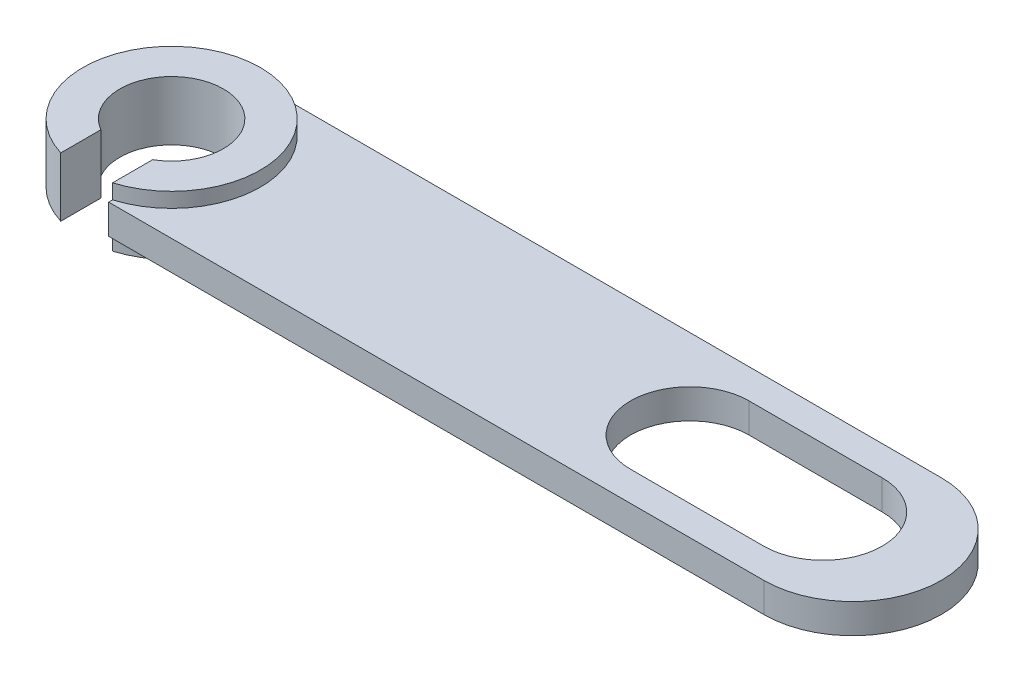
from build123d import *

# Parameters (mm, degrees)
SCHIZZO1_R                    = 1.75
ESTRUSIONE_ESTRUSIONE1_DEPTH  = 0.5
TAGLIO_ESTRUSIONE2_DEPTH      = 15.81553239
TAGLIO_ESTRUSIONE2_DEPTH_BACK = 15.81553239
ESTRUSIONE_ESTRUSIONE2_DEPTH  = 1


with BuildPart() as part:
    # Schizzo1 → Estrusione-Estrusione1 (new, symmetric)
    with BuildSketch(Plane(origin=(0, 0, 0), x_dir=(1, 0, 0), z_dir=(0, 1, 0))):
        with BuildLine():
            Line((-11.5, 3), (11.5, 3))
            ThreePointArc((11.5, 3), (14.5, 0), (11.5, -3))
            Line((11.5, -3), (-11.5, -3))
            ThreePointArc((-11.5, -3), (-14.5, 0), (-11.5, 3))
        make_face()
        with Locations(Location((-11.5, 0, 0), (0, 0, 270))):
            Circle(SCHIZZO1_R, mode=Mode.SUBTRACT)
        with BuildLine():
            Line((10.5, -2), (6, -2))
            ThreePointArc((6, -2), (4, 0), (6, 2))
            Line((6, 2), (10.5, 2))
            ThreePointArc((10.5, 2), (12.5, 0), (10.5, -2))
        make_face(mode=Mode.SUBTRACT)
    extrude(amount=ESTRUSIONE_ESTRUSIONE1_DEPTH, both=True)

    # Schizzo2 → Taglio-Estrusione2 (cut, two sides: drawn at the far end of the back side and taken through both)
    with BuildSketch(Plane(origin=(0, 0, 0), x_dir=(1, 0, 0), z_dir=(0, 1, 0)).offset(-TAGLIO_ESTRUSIONE2_DEPTH_BACK)):
        with BuildLine():
            Line((-10.625, -1.515544457), (-10.625, -3))
            Line((-10.625, -3), (-11.5, -3))
            ThreePointArc((-11.5, -3), (-11.942334595, -2.967210829), (-12.375, -2.869560071))
            Line((-12.375, -2.869560071), (-12.375, -1.515544457))
            ThreePointArc((-12.375, -1.515544457), (-11.5, -1.75), (-10.625, -1.515544457))
        make_face()
    extrude(amount=TAGLIO_ESTRUSIONE2_DEPTH + TAGLIO_ESTRUSIONE2_DEPTH_BACK, mode=Mode.SUBTRACT)

    # Schizzo4 → Estrusione-Estrusione2 (add, symmetric)
    with BuildSketch(Plane(origin=(0, 0, 0), x_dir=(1, 0, 0), z_dir=(0, 1, 0))):
        with BuildLine():
            Line((-10.625, -2.869560071), (-10.625, -1.515544457))
            ThreePointArc((-10.625, -1.515544457), (-11.5, 1.75), (-12.375, -1.515544457))
            Line((-12.375, -1.515544457), (-12.375, -2.869560071))
            ThreePointArc((-12.375, -2.869560071), (-11.5, 3), (-10.625, -2.869560071))
        make_face()
    extrude(amount=ESTRUSIONE_ESTRUSIONE2_DEPTH, both=True)


solid = part.part
